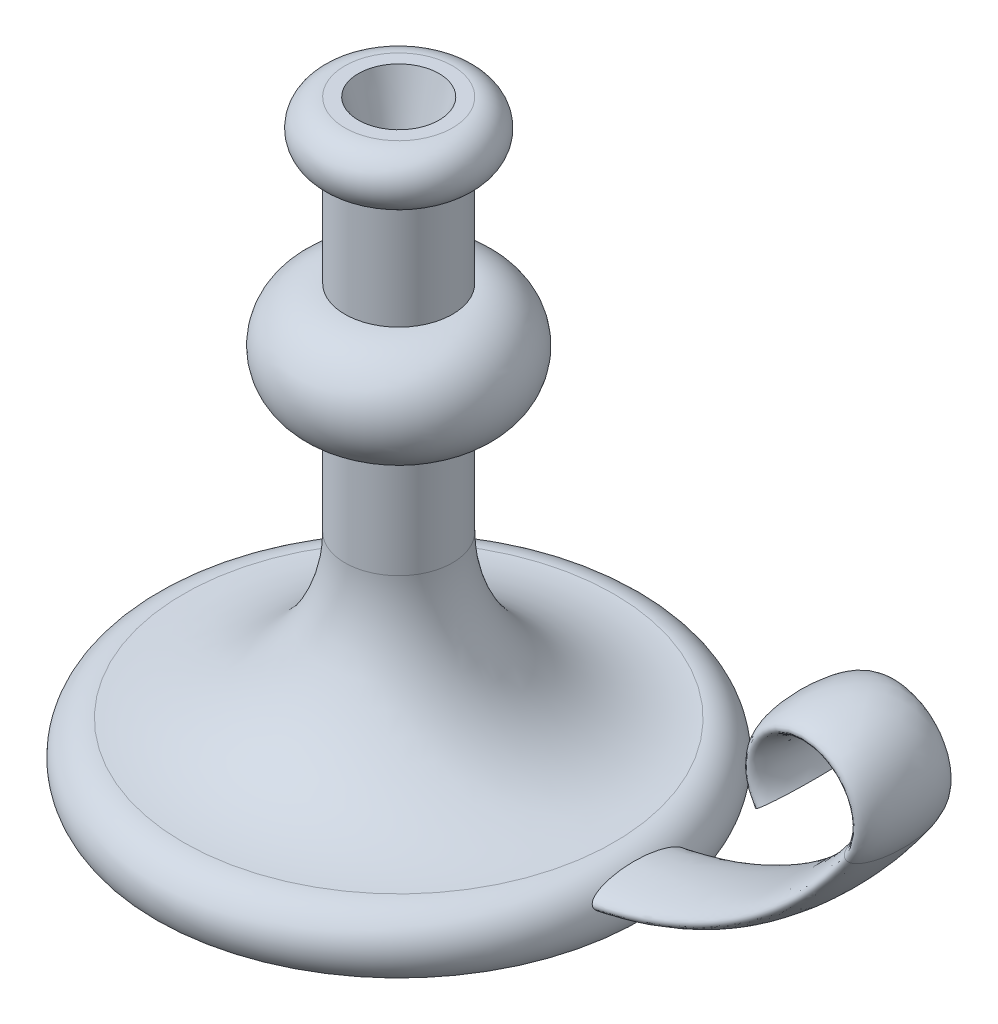
from build123d import *

# Parameters (mm, degrees)
SKETCH3_RX         = 17.5
SKETCH3_RY         = 5
SKETCH4_R          = 15
CUT_EXTRUDE1_DEPTH = 25
CUT_EXTRUDE1_DRAFT = -15


with BuildPart() as part:
    # Sketch1 → Revolve1 (revolve)
    with BuildSketch(Plane.XY, mode=Mode.PRIVATE) as revolve1_sk:
        with BuildLine():
            Line((0, 0), (0, 220))
            Line((0, 220), (20, 220))
            ThreePointArc((20, 220), (30, 210), (20, 200))
            Line((20, 200), (20, 160))
            ThreePointArc((20, 160), (40, 140), (20, 120))
            Line((20, 120), (20, 80))
            ThreePointArc((20, 80), (37.573593129, 37.573593129), (80, 20))
            ThreePointArc((80, 20), (91.180339887, 13.090169944), (90, 0))
            Line((90, 0), (0, 0))
        make_face()
    revolve(revolve1_sk.sketch.rotate(Axis((0, 0, 0), (0, 1, 0)), 90), axis=Axis((0, 0, 0), (0, 1, 0)))

    # Sweep1: sweep along a path in Sketch2
    with BuildLine(Plane.XY) as sweep1_path:
        Line((0, 10), (60, 10))
        ThreePointArc((60, 10), (129.821200219, 27.240819526), (183.592070943, 75))
        ThreePointArc((183.592070943, 75), (167.113128151, 106.333333333), (150.634185358, 75))
    # Sketch3 → Sweep1 (sweep)
    with BuildSketch(Plane(origin=(0, 0, 0), x_dir=(0, 0, -1), z_dir=(1, 0, 0))):
        with Locations((0, 10)):
            Ellipse(SKETCH3_RX, SKETCH3_RY)
    sweep(path=sweep1_path.line)


with BuildPart() as cut_extrude1_tool:
    # Sketch4 → Cut-Extrude1 (with draft: the straight prism first)
    with BuildSketch(Plane(origin=(0, 220, 0), x_dir=(1, 0, 0), z_dir=(0, 1, 0))):
        Circle(SKETCH4_R)
    extrude(amount=-CUT_EXTRUDE1_DEPTH)
    # Cut-Extrude1: the draft: its side faces are tilted about the plane it starts from
    cut_extrude1_sides = [cut_extrude1_tool.faces().sort_by_distance(p)[0] for p in [
        (-15, 207.5, 0),
    ]]
    draft(cut_extrude1_sides, Plane(origin=(0, 220, 0), x_dir=(1, 0, 0), z_dir=(0, 1, 0)), CUT_EXTRUDE1_DRAFT)


with BuildPart() as part_1:
    add(part.part)

    # Cut-Extrude1: cut by cut_extrude1_tool
    add(cut_extrude1_tool.part, mode=Mode.SUBTRACT)


solid = part_1.part
